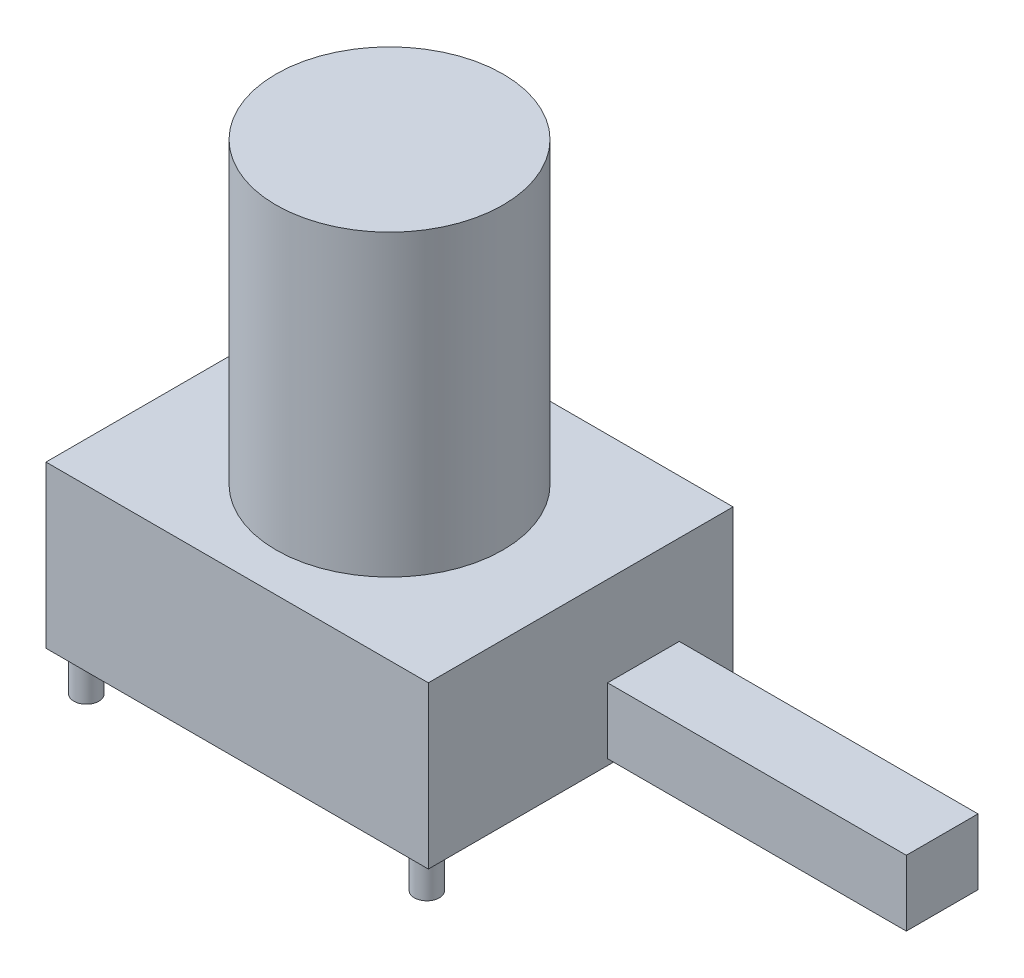
from build123d import *

# Parameters (mm, degrees)
SKETCH1_W           = 64
SKETCH1_H           = 51
BOSS_EXTRUDE1_DEPTH = 27
SKETCH2_R           = 19
BOSS_EXTRUDE2_DEPTH = 50
SKETCH3_R           = 2.1
BOSS_EXTRUDE3_DEPTH = 6.5
SKETCH4_W           = 12
SKETCH4_H           = 11
BOSS_EXTRUDE4_DEPTH = 50


with BuildPart() as part:
    # Sketch1 → Boss-Extrude1 (new body)
    with BuildSketch(Plane(origin=(0, 0, 0), x_dir=(1, 0, 0), z_dir=(0, 1, 0))):
        with Locations((32, 25.5)):
            Rectangle(SKETCH1_W, SKETCH1_H)
    extrude(amount=BOSS_EXTRUDE1_DEPTH)

    # Sketch2 → Boss-Extrude2 (add)
    with BuildSketch(Plane(origin=(0, 27, 0), x_dir=(1, 0, 0), z_dir=(0, 1, 0))):
        with Locations(Location((32, 25.5, 0), (0, 0, 90))):
            Circle(SKETCH2_R)
    extrude(amount=BOSS_EXTRUDE2_DEPTH)

    # Sketch3 → Boss-Extrude3 (add)
    with BuildSketch(Plane.XZ):
        with Locations(Location((3.5, -3.25, 0), (0, 0, 90))):
            Circle(SKETCH3_R)
        with Locations(Location((60.5, -3.25, 0), (0, 0, 90))):
            Circle(SKETCH3_R)
        with Locations(Location((3.5, -47.75, 0), (0, 0, 90))):
            Circle(SKETCH3_R)
        with Locations(Location((60.5, -47.75, 0), (0, 0, 90))):
            Circle(SKETCH3_R)
    extrude(amount=BOSS_EXTRUDE3_DEPTH)

    # Sketch4 → Boss-Extrude4 (add)
    with BuildSketch(Plane(origin=(64, 0, 0), x_dir=(0, 0, -1), z_dir=(1, 0, 0))):
        with Locations((36, 6.5)):
            Rectangle(SKETCH4_W, SKETCH4_H)
    extrude(amount=BOSS_EXTRUDE4_DEPTH)


solid = part.part
